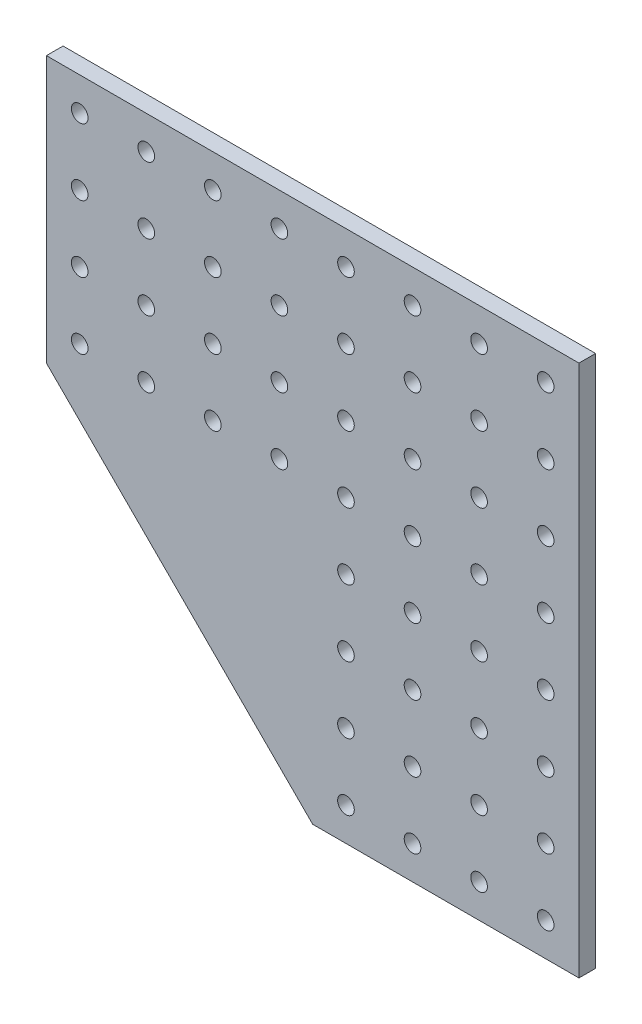
from build123d import *

# Parameters (mm, degrees)
EXTRUSION1_DEPTH = 6.35
HOLE1_D          = 6.35


with BuildPart() as part:
    # Sketch1 → Extrusion1 (new body)
    with BuildSketch(Plane.XY):
        Polygon((-72.704579377, 193.412844037), (-72.704579377, 91.812844037), (28.895420623, -9.787155963), (130.495420623, -9.787155963), (130.495420623, 193.412844037), align=None)
    extrude(amount=EXTRUSION1_DEPTH)

    # Hole1 (through all)
    with Locations(Plane.XY.offset(6.35)):
        with Locations((-60.004579377, 180.712844037), (-34.604579377, 180.712844037), (-60.004579377, 155.312844037), (-34.604579377, 155.312844037), (-60.004579377, 129.912844037), (-34.604579377, 129.912844037), (-60.004579377, 104.512844037), (-34.604579377, 104.512844037), (117.795420623, 79.112844037), (117.795420623, 53.712844037), (92.395420623, 79.112844037), (92.395420623, 53.712844037), (-9.204579377, 180.712844037), (-9.204579377, 155.312844037), (-9.204579377, 129.912844037), (-9.204579377, 104.512844037), (16.195420623, 180.712844037), (16.195420623, 155.312844037), (16.195420623, 129.912844037), (16.195420623, 104.512844037), (41.595420623, 180.712844037), (41.595420623, 155.312844037), (41.595420623, 129.912844037), (41.595420623, 104.512844037), (66.995420623, 180.712844037), (66.995420623, 155.312844037), (66.995420623, 129.912844037), (66.995420623, 104.512844037), (92.395420623, 180.712844037), (92.395420623, 155.312844037), (92.395420623, 129.912844037), (92.395420623, 104.512844037), (117.795420623, 180.712844037), (117.795420623, 155.312844037), (117.795420623, 129.912844037), (117.795420623, 104.512844037), (117.795420623, 28.312844037), (92.395420623, 28.312844037), (117.795420623, 2.912844037), (92.395420623, 2.912844037), (66.995420623, 79.112844037), (66.995420623, 53.712844037), (66.995420623, 28.312844037), (66.995420623, 2.912844037), (41.595420623, 79.112844037), (41.595420623, 53.712844037), (41.595420623, 28.312844037), (41.595420623, 2.912844037)):
            Hole(HOLE1_D / 2)


solid = part.part
